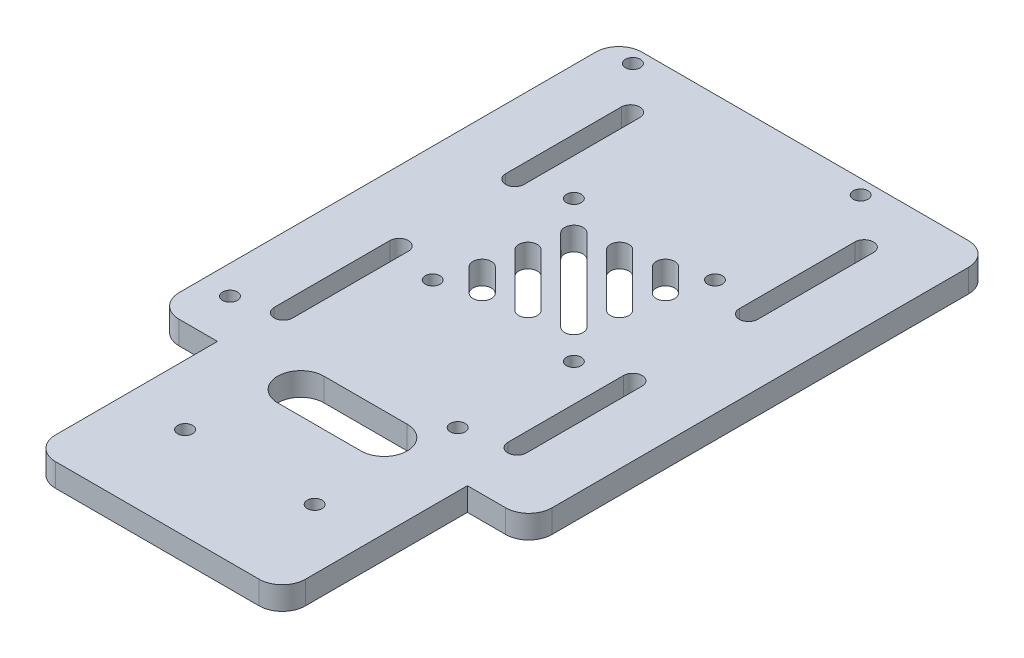
from build123d import *

# Parameters (mm, degrees)
SKETCH_1_W          = 54
SKETCH_1_H          = 40
SKETCH_1_R          = 1.6
SKETCH_1_W_2        = 80.56
SKETCH_1_H_2        = 100
EXTRUDE_1_DEPTH     = 5
CUT_EXTRUDE_5_DEPTH = 99.729318847
FILLET_1_R          = 5


with BuildPart() as part:
    # 草图1 → 凸台-拉伸1 (new body)
    # profile 1 of 2: a face of its own
    with BuildSketch(Plane(origin=(0, 0, 0), x_dir=(1, 0, 0), z_dir=(0, 1, 0))):
        with Locations((0, -70)):
            Rectangle(SKETCH_1_W, SKETCH_1_H)
        with Locations(Location((-14, -70, 0), (0, 0, 270))):
            Circle(SKETCH_1_R, mode=Mode.SUBTRACT)
        with Locations(Location((14, -70, 0), (0, 0, 270))):
            Circle(SKETCH_1_R, mode=Mode.SUBTRACT)
    # profile 2 of 2: a face of its own
    with BuildSketch(Plane(origin=(0, 0, 0), x_dir=(1, 0, 0), z_dir=(0, 1, 0))):
        Rectangle(SKETCH_1_W_2, SKETCH_1_H_2)
        with Locations(Location((15.25, 15.25, 0), (0, 0, 270))):
            Circle(SKETCH_1_R, mode=Mode.SUBTRACT)
        with Locations(Location((-15.25, 15.25, 0), (0, 0, 270))):
            Circle(SKETCH_1_R, mode=Mode.SUBTRACT)
        with Locations(Location((-34.12, -40.19, 0), (0, 0, 270))):
            Circle(SKETCH_1_R, mode=Mode.SUBTRACT)
        with Locations(Location((15.09, -40.19, 0), (0, 0, 270))):
            Circle(SKETCH_1_R, mode=Mode.SUBTRACT)
        with Locations(Location((15.09, 46.89, 0), (0, 0, 270))):
            Circle(SKETCH_1_R, mode=Mode.SUBTRACT)
        with Locations(Location((-34.12, 46.89, 0), (0, 0, 270))):
            Circle(SKETCH_1_R, mode=Mode.SUBTRACT)
        with Locations(Location((15.25, -15.25, 0), (0, 0, 270))):
            Circle(SKETCH_1_R, mode=Mode.SUBTRACT)
        with Locations(Location((-15.25, -15.25, 0), (0, 0, 270))):
            Circle(SKETCH_1_R, mode=Mode.SUBTRACT)
    extrude(amount=EXTRUDE_1_DEPTH)

    # 草图7 → 切除-拉伸5 (cut, through all)
    with BuildSketch(Plane(origin=(0, 0, 0), x_dir=(1, 0, 0), z_dir=(0, 1, 0))):
        with BuildLine():
            ThreePointArc((-6.01040764, -10.960155108), (-6.01040764, -13.788582233), (-8.838834765, -13.788582233))
            Line((-8.838834765, -13.788582233), (-13.788582233, -8.838834765))
            ThreePointArc((-13.788582233, -8.838834765), (-13.788582233, -6.01040764), (-10.960155108, -6.01040764))
            Line((-10.960155108, -6.01040764), (-6.01040764, -10.960155108))
        make_face()
        with BuildLine():
            ThreePointArc((2.121320344, -9.192388155), (2.121320344, -12.02081528), (-0.707106781, -12.02081528))
            Line((-0.707106781, -12.02081528), (-12.02081528, -0.707106781))
            ThreePointArc((-12.02081528, -0.707106781), (-12.02081528, 2.121320344), (-9.192388155, 2.121320344))
            Line((-9.192388155, 2.121320344), (2.121320344, -9.192388155))
        make_face()
        with BuildLine():
            Line((-10.253048327, 7.424621202), (7.424621202, -10.253048327))
            ThreePointArc((7.424621202, -10.253048327), (10.253048327, -10.253048327), (10.253048327, -7.424621202))
            Line((10.253048327, -7.424621202), (-7.424621202, 10.253048327))
            ThreePointArc((-7.424621202, 10.253048327), (-10.253048327, 10.253048327), (-10.253048327, 7.424621202))
        make_face()
        with BuildLine():
            Line((-2.121320344, 9.192388155), (9.192388155, -2.121320344))
            ThreePointArc((9.192388155, -2.121320344), (12.02081528, -2.121320344), (12.02081528, 0.707106781))
            Line((12.02081528, 0.707106781), (0.707106781, 12.02081528))
            ThreePointArc((0.707106781, 12.02081528), (-2.121320344, 12.02081528), (-2.121320344, 9.192388155))
        make_face()
        with BuildLine():
            Line((6.01040764, 10.960155108), (10.960155108, 6.01040764))
            ThreePointArc((10.960155108, 6.01040764), (13.788582233, 6.01040764), (13.788582233, 8.838834765))
            Line((13.788582233, 8.838834765), (8.838834765, 13.788582233))
            ThreePointArc((8.838834765, 13.788582233), (6.01040764, 13.788582233), (6.01040764, 10.960155108))
        make_face()
        with BuildLine():
            ThreePointArc((-23.25, 12.5), (-25.25, 10.5), (-27.25, 12.5))
            Line((-27.25, 12.5), (-27.25, 37.5))
            ThreePointArc((-27.25, 37.5), (-25.25, 39.5), (-23.25, 37.5))
            Line((-23.25, 37.5), (-23.25, 12.5))
        make_face()
        with BuildLine():
            Line((23.25, 37.5), (23.25, 12.5))
            ThreePointArc((23.25, 12.5), (25.25, 10.5), (27.25, 12.5))
            Line((27.25, 12.5), (27.25, 37.5))
            ThreePointArc((27.25, 37.5), (25.25, 39.5), (23.25, 37.5))
        make_face()
        with BuildLine():
            Line((-23.25, -37.5), (-23.25, -12.5))
            ThreePointArc((-23.25, -12.5), (-25.25, -10.5), (-27.25, -12.5))
            Line((-27.25, -12.5), (-27.25, -37.5))
            ThreePointArc((-27.25, -37.5), (-25.25, -39.5), (-23.25, -37.5))
        make_face()
        with BuildLine():
            ThreePointArc((23.25, -12.5), (25.25, -10.5), (27.25, -12.5))
            Line((27.25, -12.5), (27.25, -37.5))
            ThreePointArc((27.25, -37.5), (25.25, -39.5), (23.25, -37.5))
            Line((23.25, -37.5), (23.25, -12.5))
        make_face()
        with BuildLine():
            Line((-9, -55), (9, -55))
            ThreePointArc((9, -55), (14, -50), (9, -45))
            Line((9, -45), (-9, -45))
            ThreePointArc((-9, -45), (-14, -50), (-9, -55))
        make_face()
    extrude(amount=CUT_EXTRUDE_5_DEPTH, mode=Mode.SUBTRACT)

    # 圆角1
    fillet_1_edges = [part.edges().sort_by_distance(p)[0] for p in [
        (-40.28, 2.5, 50),
        (-40.28, 2.5, -50),
        (40.28, 2.5, -50),
        (40.28, 2.5, 50),
        (27, 2.5, 90),
        (-27, 2.5, 90),
    ]]
    fillet(fillet_1_edges, radius=FILLET_1_R)


solid = part.part
